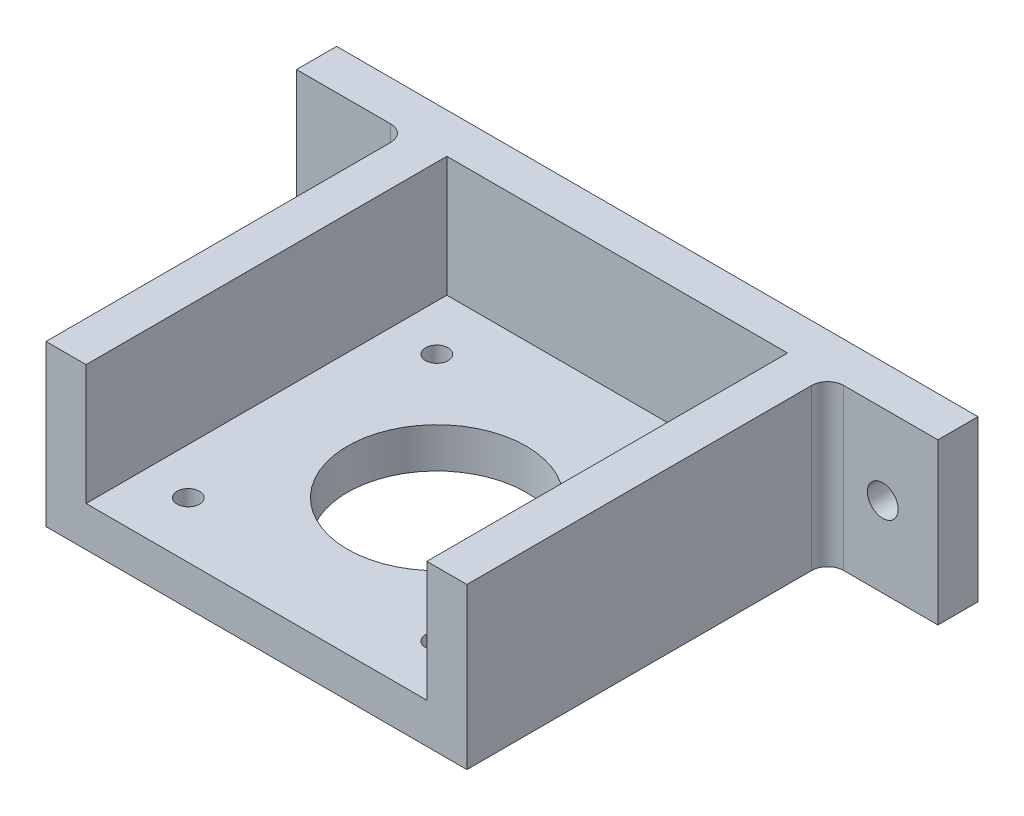
from build123d import *

# Parameters (mm, degrees)
BOSS_EXTRUDE1_DEPTH = 45
SKETCH2_W           = 5
SKETCH2_H           = 20
BOSS_EXTRUDE3_DEPTH = 40
SKETCH3_R           = 1.925
CUT_EXTRUDE1_DEPTH  = 200
SKETCH4_R           = 11.15
CUT_EXTRUDE2_DEPTH  = 200
SKETCH5_R           = 1.4
CUT_EXTRUDE3_DEPTH  = 200
FILLET1_R           = 2


with BuildPart() as part:
    # Sketch1 → Boss-Extrude1 (new body)
    with BuildSketch(Plane.XY):
        Polygon((26.25, 0), (-26.25, 0), (-26.25, 20), (-21.25, 20), (-21.25, 5), (21.25, 5), (21.25, 20), (26.25, 20), align=None)
    extrude(amount=BOSS_EXTRUDE1_DEPTH)

    # Sketch2 → Boss-Extrude3 (add, symmetric)
    with BuildSketch(Plane(origin=(0, 0, 0), x_dir=(0, 0, -1), z_dir=(1, 0, 0))):
        with Locations((2.5, 10)):
            Rectangle(SKETCH2_W, SKETCH2_H)
    extrude(amount=BOSS_EXTRUDE3_DEPTH, both=True)

    # Sketch3 → Cut-Extrude1 (cut)
    with BuildSketch(Plane.XY):
        with Locations((-33.125, 10)):
            Circle(SKETCH3_R)
        with Locations(Location((33.125, 10, 0), (0, 0, 270))):
            Circle(SKETCH3_R)
    extrude(amount=-CUT_EXTRUDE1_DEPTH, mode=Mode.SUBTRACT)

    # Sketch4 → Cut-Extrude2 (cut)
    with BuildSketch(Plane(origin=(0, 5, 0), x_dir=(1, 0, 0), z_dir=(0, 1, 0))):
        with Locations(Location((0, -22.5, 0), (0, 0, 270))):
            Circle(SKETCH4_R)
    extrude(amount=-CUT_EXTRUDE2_DEPTH, mode=Mode.SUBTRACT)

    # Sketch5 → Cut-Extrude3 (cut)
    with BuildSketch(Plane(origin=(0, 5, 0), x_dir=(1, 0, 0), z_dir=(0, 1, 0))):
        with Locations(Location((-15.5, -7, 0), (0, 0, 270))):
            Circle(SKETCH5_R)
        with Locations(Location((15.5, -7, 0), (0, 0, 270))):
            Circle(SKETCH5_R)
        with Locations(Location((-15.5, -38, 0), (0, 0, 270))):
            Circle(SKETCH5_R)
        with Locations(Location((15.5, -38, 0), (0, 0, 270))):
            Circle(SKETCH5_R)
    extrude(amount=-CUT_EXTRUDE3_DEPTH, mode=Mode.SUBTRACT)

    # Fillet1
    fillet1_edges = [part.edges().sort_by_distance(p)[0] for p in [
        (-26.25, 10, 0),
        (26.25, 10, 0),
    ]]
    fillet(fillet1_edges, radius=FILLET1_R)


solid = part.part
